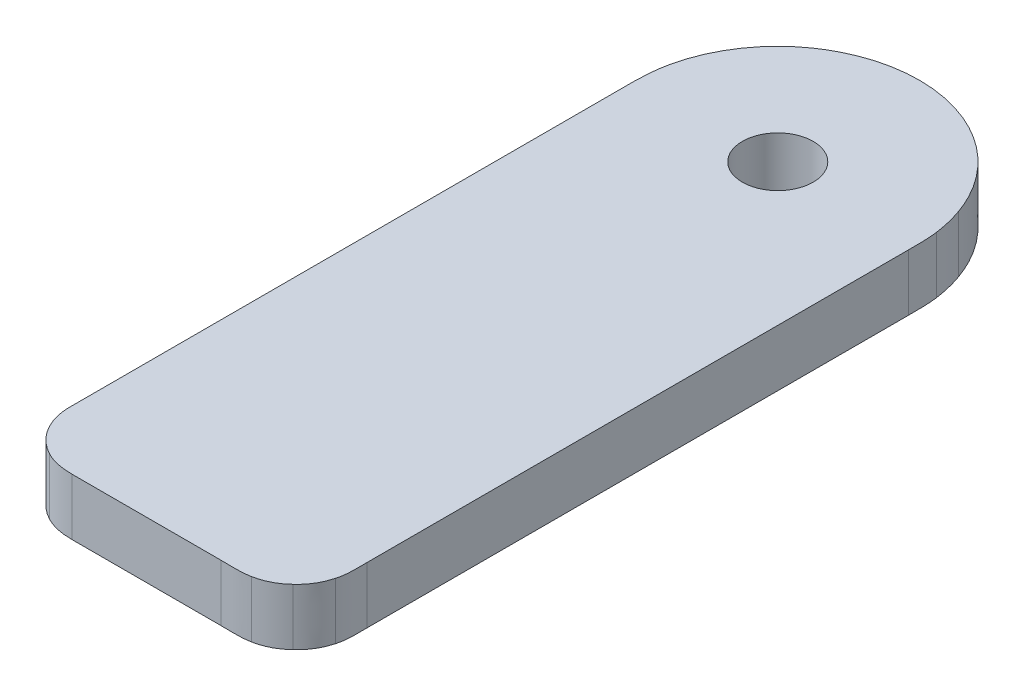
from build123d import *

# Parameters (mm, degrees)
SKETCH2_R           = 3.96875
BOSS_EXTRUDE1_DEPTH = 6.35


with BuildPart() as part:
    # Sketch2 → Boss-Extrude1 (new body)
    with BuildSketch(Plane(origin=(0, 0, 0), x_dir=(1, 0, 0), z_dir=(0, 1, 0))):
        with BuildLine():
            add(Edge.make_bspline(
                [(3.653282, 0.952754), (1.53731762, 2.045327599), (0.219425103, 4.227383391), (0.2289048, 6.614546142)],
                knots=[0, 0, 0, 0, 1.003586212, 1.003586212, 1.003586212, 1.003586212], degree=3))
            Line((0.2289048, 6.614546142), (0.2289048, 6.612006142))
            add(Edge.make_bspline(
                [(0.2289048, 6.612006142), (0.2289048, 24.601452828), (0.2289048, 42.590899503), (0.2289048, 60.5803208)],
                knots=[0.000430551, 0.000430551, 0.000430551, 0.000430551, 1, 1, 1, 1], degree=3))
            add(Edge.make_bspline(
                [(0.2289048, 60.5803208), (0.2289048, 62.771401), (0.2289048, 64.9693646), (0.2289048, 67.1604702)],
                knots=[0, 0, 0, 0, 1, 1, 1, 1], degree=3))
            add(Edge.make_bspline(
                [(0.2289048, 67.1604702), (0.2289048, 69.3101738), (0.1324102, 71.4323692), (0.6078474, 73.5821236)],
                knots=[0, 0, 0, 0, 1, 1, 1, 1], degree=3))
            add(Edge.make_bspline(
                [(0.6078474, 73.5821236), (1.6413734, 78.1985736), (4.6799754, 82.1121548), (8.8967564, 84.2550004)],
                knots=[0, 0, 0, 0, 1, 1, 1, 1], degree=3))
            add(Edge.make_bspline(
                [(8.8967564, 84.2550004), (17.4474886, 88.6096018), (27.8240998, 84.4895186), (31.048706, 75.4562626)],
                knots=[0, 0, 0, 0, 1, 1, 1, 1], degree=3))
            add(Edge.make_bspline(
                [(31.048706, 75.4562626), (31.4345574, 74.38136), (31.6963806, 73.292716), (31.8479678, 72.1627208)],
                knots=[0, 0, 0, 0, 1, 1, 1, 1], degree=3))
            add(Edge.make_bspline(
                [(31.8479678, 72.1627208), (31.9857374, 71.0740514), (31.9788794, 69.9854074), (31.9788794, 68.8967634)],
                knots=[0, 0, 0, 0, 1, 1, 1, 1], degree=3))
            add(Edge.make_bspline(
                [(31.9788794, 68.8967634), (31.9788794, 66.6368238), (31.9788794, 64.376808), (31.9788794, 62.123701)],
                knots=[0, 0, 0, 0, 1, 1, 1, 1], degree=3))
            add(Edge.make_bspline(
                [(31.9788794, 62.123701), (31.9788794, 57.603771), (31.9788794, 53.0906736), (31.9788794, 48.5776016)],
                knots=[0, 0, 0, 0, 1, 1, 1, 1], degree=3))
            add(Edge.make_bspline(
                [(31.9788794, 48.5776016), (31.9788794, 39.5652244), (31.9788794, 30.559756), (31.9788794, 21.5542622)],
                knots=[0, 0, 0, 0, 1, 1, 1, 1], degree=3))
            add(Edge.make_bspline(
                [(31.9788794, 21.5542622), (31.9788794, 17.0963082), (31.9788794, 12.6383542), (31.9788794, 8.187309)],
                knots=[0, 0, 0, 0, 1, 1, 1, 1], degree=3))
            add(Edge.make_bspline(
                [(31.9788794, 8.187309), (31.9788794, 7.0917562), (32.0547238, 6.010021), (31.7514732, 4.9144682)],
                knots=[0, 0, 0, 0, 1, 1, 1, 1], degree=3))
            add(Edge.make_bspline(
                [(31.7514732, 4.9144682), (31.4207398, 3.7087048), (30.8557676, 2.778506), (29.939361, 1.9310096)],
                knots=[0, 0, 0, 0, 1, 1, 1, 1], degree=3))
            add(Edge.make_bspline(
                [(29.939361, 1.9310096), (29.0298632, 1.0835132), (28.0721054, 0.601218), (26.8525752, 0.3600704)],
                knots=[0, 0, 0, 0, 1, 1, 1, 1], degree=3))
            add(Edge.make_bspline(
                [(26.8525752, 0.3600704), (25.756997, 0.146558), (24.6683784, 0.2430526), (23.5728256, 0.2430526)],
                knots=[0, 0, 0, 0, 1, 1, 1, 1], degree=3))
            add(Edge.make_bspline(
                [(23.5728256, 0.2430526), (19.1217804, 0.2430526), (14.6707098, 0.2430526), (10.2196392, 0.2430526)],
                knots=[0, 0, 0, 0, 1, 1, 1, 1], degree=3))
            add(Edge.make_bspline(
                [(10.2196392, 0.2430526), (9.1034362, 0.2430526), (7.9872332, 0.2430526), (6.8778882, 0.2430526)],
                knots=[0, 0, 0, 0, 1, 1, 1, 1], degree=3))
            add(Edge.make_bspline(
                [(6.8778882, 0.2430526), (5.7272428, 0.2430526), (4.7006002, 0.4155694), (3.653282, 0.952754)],
                knots=[0, 0, 0, 0, 1, 1, 1, 1], degree=3))
        make_face()
        with Locations(Location((16.096996, 70.13702, 0), (0, 0, 270))):
            Circle(SKETCH2_R, mode=Mode.SUBTRACT)
    extrude(amount=BOSS_EXTRUDE1_DEPTH)


solid = part.part
